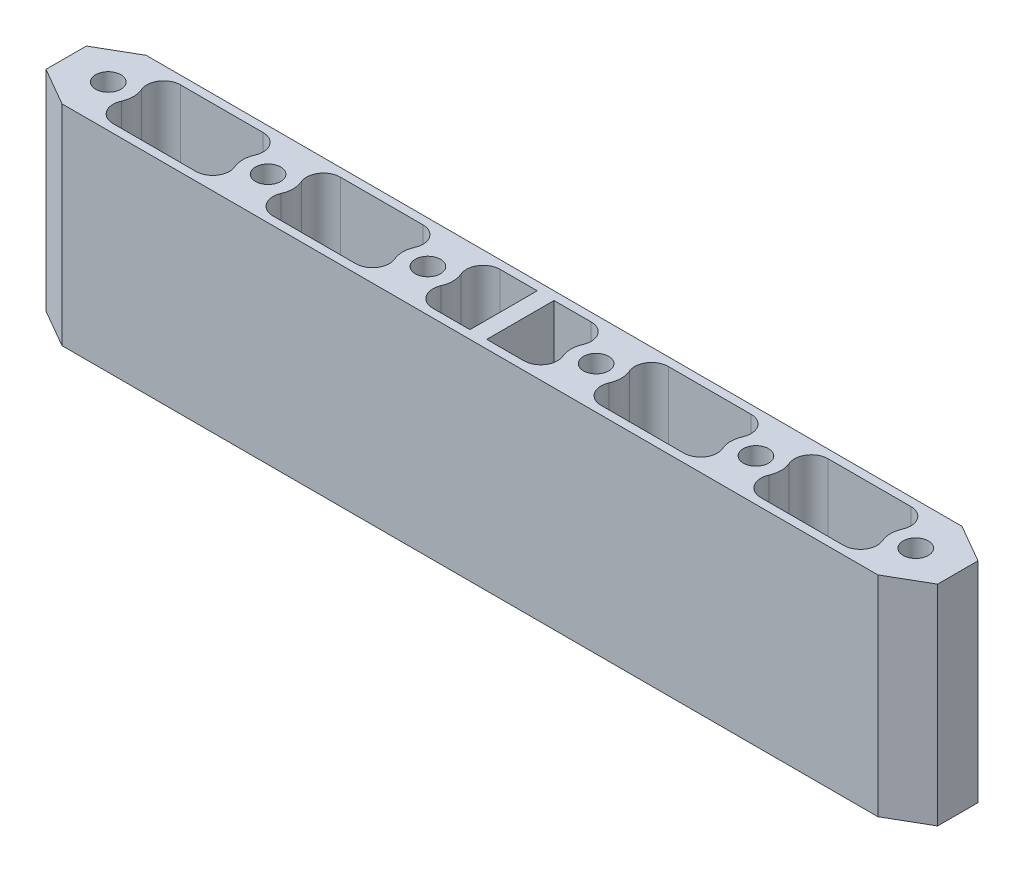
from build123d import *

# Parameters (mm, degrees)
SKETCH1_R           = 3
BOSS_EXTRUDE1_DEPTH = 49.8


with BuildPart() as part:
    # Sketch1 → Boss-Extrude1 (new body)
    with BuildSketch(Plane(origin=(0, 0, 0), x_dir=(1, 0, 0), z_dir=(0, 1, 0))):
        Polygon((-149.99, -10), (43.99, -10), (53, -4.8), (53, 4.8), (43.99, 10), (-149.99, 10), (-159, 4.8), (-159, -4.8), align=None)
        with BuildLine():
            ThreePointArc((33.8348486, 8), (37.1814887, 6.190890255), (37.500909186, 2.400000045))
            ThreePointArc((37.500909186, 2.400000045), (37, 1e-09), (37.500909185, -2.400000042))
            ThreePointArc((37.500909185, -2.400000042), (37.181488707, -6.190890243), (33.834848625, -8))
            Line((33.834848625, -8), (14.165151315, -8))
            ThreePointArc((14.165151315, -8), (10.818511261, -6.190890195), (10.499090838, -2.399999991))
            ThreePointArc((10.499090838, -2.399999991), (11, -3e-09), (10.49909084, 2.399999985))
            ThreePointArc((10.49909084, 2.399999985), (10.81851128, 6.190890224), (14.165151391, 8))
            Line((14.165151391, 8), (33.8348486, 8))
        make_face(mode=Mode.SUBTRACT)
        with BuildLine():
            ThreePointArc((-0.499090895, 2.39999986), (-1, 1.1e-08), (-0.499090904, -2.399999839))
            ThreePointArc((-0.499090904, -2.399999839), (-0.818511236, -6.190890157), (-4.16515139, -8))
            Line((-4.16515139, -8), (-23.83484861, -8))
            ThreePointArc((-23.83484861, -8), (-27.181488692, -6.190890267), (-27.500909202, -2.400000081))
            ThreePointArc((-27.500909202, -2.400000081), (-27, -3.4e-08), (-27.500909174, 2.400000019))
            ThreePointArc((-27.500909174, 2.400000019), (-27.181488711, 6.190890238), (-23.83484861, 8))
            Line((-23.83484861, 8), (-4.165151415, 8))
            ThreePointArc((-4.165151415, 8), (-0.818511249, 6.190890177), (-0.499090895, 2.39999986))
        make_face(mode=Mode.SUBTRACT)
        with BuildLine():
            ThreePointArc((-38.499090754, -2.400000183), (-38.818511346, -6.190890325), (-42.165151417, -8))
            Line((-42.165151417, -8), (-51, -8))
            Line((-51, -8), (-51, 8))
            Line((-51, 8), (-42.165151363, 8))
            ThreePointArc((-42.165151363, 8), (-38.818511221, 6.190890134), (-38.499090914, 2.399999815))
            ThreePointArc((-38.499090914, 2.399999815), (-39, -2e-07), (-38.499090754, -2.400000183))
        make_face(mode=Mode.SUBTRACT)
        with BuildLine():
            Line((-55, 8), (-55, -8))
            Line((-55, -8), (-63.834848637, -8))
            ThreePointArc((-63.834848637, -8), (-67.181488771, -6.190890146), (-67.500909096, -2.39999984))
            ThreePointArc((-67.500909096, -2.39999984), (-67, 9e-08), (-67.500909168, 2.400000005))
            ThreePointArc((-67.500909168, 2.400000005), (-67.181488707, 6.190890244), (-63.834848583, 8))
            Line((-63.834848583, 8), (-55, 8))
        make_face(mode=Mode.SUBTRACT)
        with BuildLine():
            ThreePointArc((-78.499090904, 2.39999984), (-79, -1.79e-07), (-78.49909076, -2.400000169))
            ThreePointArc((-78.49909076, -2.400000169), (-78.818511334, -6.190890307), (-82.16515139, -8))
            Line((-82.16515139, -8), (-101.83484861, -8))
            ThreePointArc((-101.83484861, -8), (-105.181488717, -6.190890228), (-105.500909164, -2.399999996))
            ThreePointArc((-105.500909164, -2.399999996), (-105, 1.3e-08), (-105.500909175, 2.40000002))
            ThreePointArc((-105.500909175, 2.40000002), (-105.18148871, 6.190890239), (-101.83484861, 8))
            Line((-101.83484861, 8), (-82.16515139, 8))
            ThreePointArc((-82.16515139, 8), (-78.818511236, 6.190890157), (-78.499090904, 2.39999984))
        make_face(mode=Mode.SUBTRACT)
        with BuildLine():
            ThreePointArc((-116.499090787, 2.400000107), (-117, 5.5e-08), (-116.499090832, -2.400000005))
            ThreePointArc((-116.499090832, -2.400000005), (-116.818511285, -6.190890232), (-120.16515139, -8))
            Line((-120.16515139, -8), (-139.83484861, -8))
            ThreePointArc((-139.83484861, -8), (-143.181488722, -6.190890221), (-143.500909157, -2.39999998))
            ThreePointArc((-143.500909157, -2.39999998), (-143, 1.5e-08), (-143.500909169, 2.400000007))
            ThreePointArc((-143.500909169, 2.400000007), (-143.181488714, 6.190890233), (-139.83484861, 8))
            Line((-139.83484861, 8), (-120.16515139, 8))
            ThreePointArc((-120.16515139, 8), (-116.818511316, 6.190890279), (-116.499090787, 2.400000107))
        make_face(mode=Mode.SUBTRACT)
        with Locations(Location((-149, 0, 0), (0, 0, 270))):
            Circle(SKETCH1_R, mode=Mode.SUBTRACT)
        with Locations(Location((-73, 0, 0), (0, 0, 270))):
            Circle(SKETCH1_R, mode=Mode.SUBTRACT)
        with Locations(Location((-111, 0, 0), (0, 0, 270))):
            Circle(SKETCH1_R, mode=Mode.SUBTRACT)
        with Locations(Location((-33, 0, 0), (0, 0, 270))):
            Circle(SKETCH1_R, mode=Mode.SUBTRACT)
        with Locations(Location((5, 0, 0), (0, 0, 270))):
            Circle(SKETCH1_R, mode=Mode.SUBTRACT)
        with Locations(Location((43, 0, 0), (0, 0, 270))):
            Circle(SKETCH1_R, mode=Mode.SUBTRACT)
    extrude(amount=BOSS_EXTRUDE1_DEPTH)


solid = part.part
